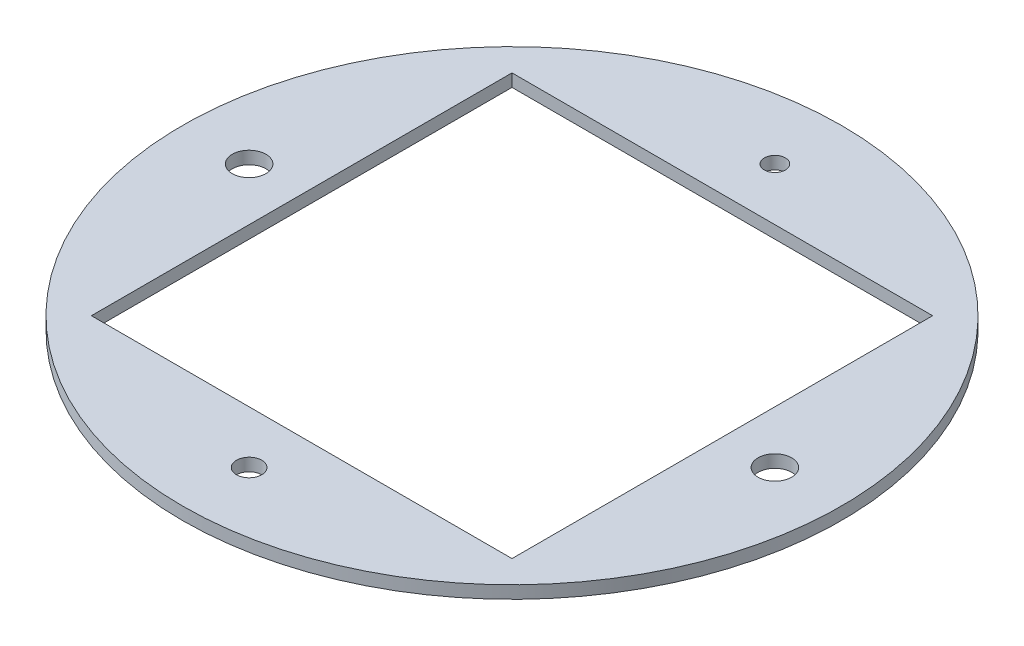
from build123d import *

# Parameters (mm, degrees)
SKETCH1_R           = 78.35
SKETCH1_R_2         = 4
SKETCH1_R_3         = 3
SKETCH1_R_4         = 2.5
SKETCH1_W           = 100
SKETCH1_H           = 100
BOSS_EXTRUDE1_DEPTH = 3


with BuildPart() as part:
    # Sketch1 → Boss-Extrude1 (new body)
    with BuildSketch(Plane(origin=(0, 0, 0), x_dir=(1, 0, 0), z_dir=(0, 1, 0))):
        with Locations(Location((0, 0, 0), (0, 0, 270))):
            Circle(SKETCH1_R)
        with Locations(Location((-62.5, 0, 0), (0, 0, 270))):
            Circle(SKETCH1_R_2, mode=Mode.SUBTRACT)
        with Locations(Location((0, -62.5, 0), (0, 0, 270))):
            Circle(SKETCH1_R_3, mode=Mode.SUBTRACT)
        with Locations(Location((0, 62.5, 0), (0, 0, 270))):
            Circle(SKETCH1_R_4, mode=Mode.SUBTRACT)
        with Locations(Location((62.5, 0, 0), (0, 0, 270))):
            Circle(SKETCH1_R_2, mode=Mode.SUBTRACT)
        Rectangle(SKETCH1_W, SKETCH1_H, mode=Mode.SUBTRACT)
    extrude(amount=BOSS_EXTRUDE1_DEPTH)


solid = part.part
